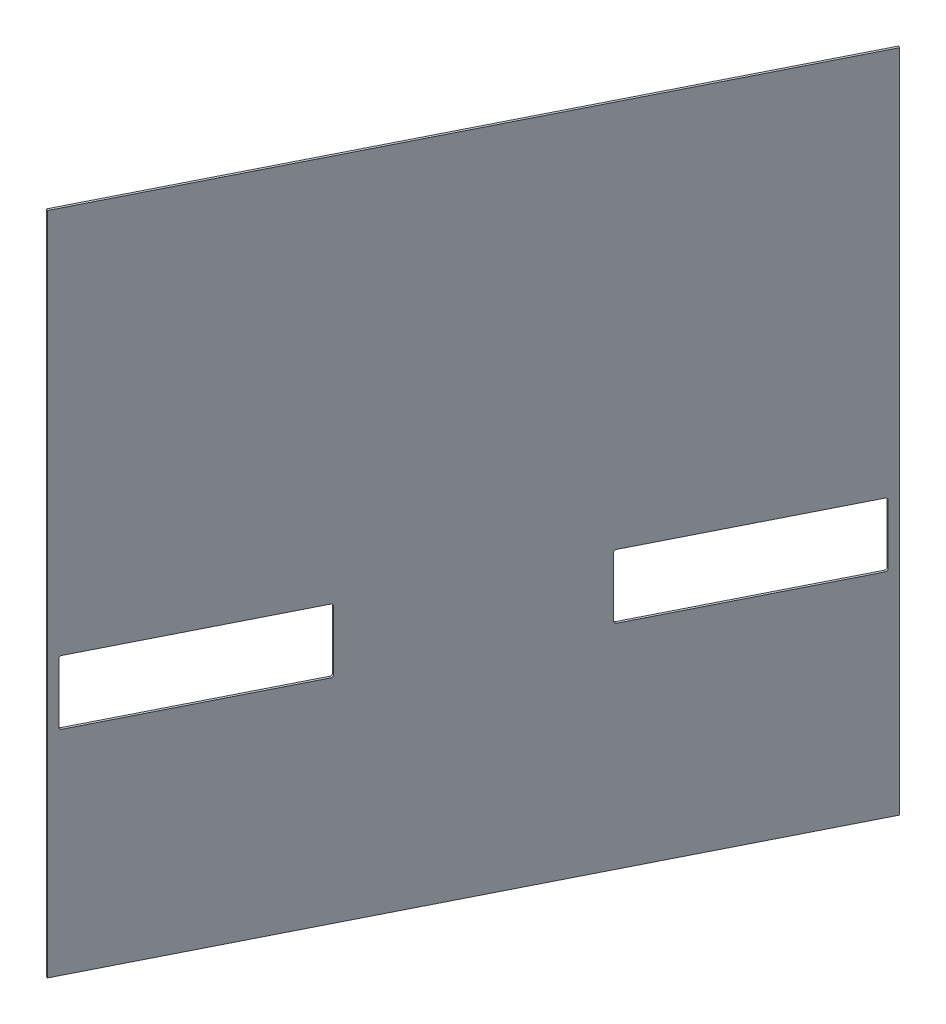
from build123d import *

# Parameters (mm, degrees)
BOSS_EXTRUDE1_DEPTH = 6.35


with BuildPart() as part:
    # Sketch1 → Boss-Extrude1 (new body)
    with BuildSketch(Plane(origin=(-4014.627423578, 0, -2017.507429852), x_dir=(0.44902769125579206, 0, -0.8935178411679832), z_dir=(0.8935178411679832, 0, 0.44902769125579206))):
        Polygon((5982.803488378, 1987.55), (5036.653488378, 1987.55), (5036.653488378, 6.35), (5982.803488378, 6.35), (6928.953488378, 6.35), (6928.953488378, 1987.55), align=None)
        with BuildLine():
            Line((6293.953488378, 825.5), (6293.953488378, 647.7))
            ThreePointArc((6293.953488378, 647.7), (6295.813360317, 643.209871939), (6300.303488378, 641.35))
            Line((6300.303488378, 641.35), (6897.203488378, 641.35))
            ThreePointArc((6897.203488378, 641.35), (6901.693616438, 643.209871939), (6903.553488378, 647.7))
            Line((6903.553488378, 647.7), (6903.553488378, 825.5))
            ThreePointArc((6903.553488378, 825.5), (6901.693616438, 829.990128061), (6897.203488378, 831.85))
            Line((6897.203488378, 831.85), (6300.303488378, 831.85))
            ThreePointArc((6300.303488378, 831.85), (6295.813360317, 829.990128061), (6293.953488378, 825.5))
        make_face(mode=Mode.SUBTRACT)
        with BuildLine():
            Line((5068.403488378, 641.35), (5665.303488378, 641.35))
            ThreePointArc((5665.303488378, 641.35), (5669.793616438, 643.209871939), (5671.653488378, 647.7))
            Line((5671.653488378, 647.7), (5671.653488378, 825.5))
            ThreePointArc((5671.653488378, 825.5), (5669.793616438, 829.990128061), (5665.303488378, 831.85))
            Line((5665.303488378, 831.85), (5068.403488378, 831.85))
            ThreePointArc((5068.403488378, 831.85), (5063.913360317, 829.990128061), (5062.053488378, 825.5))
            Line((5062.053488378, 825.5), (5062.053488378, 647.7))
            ThreePointArc((5062.053488378, 647.7), (5063.913360317, 643.209871939), (5068.403488378, 641.35))
        make_face(mode=Mode.SUBTRACT)
    extrude(amount=-BOSS_EXTRUDE1_DEPTH)


solid = part.part
